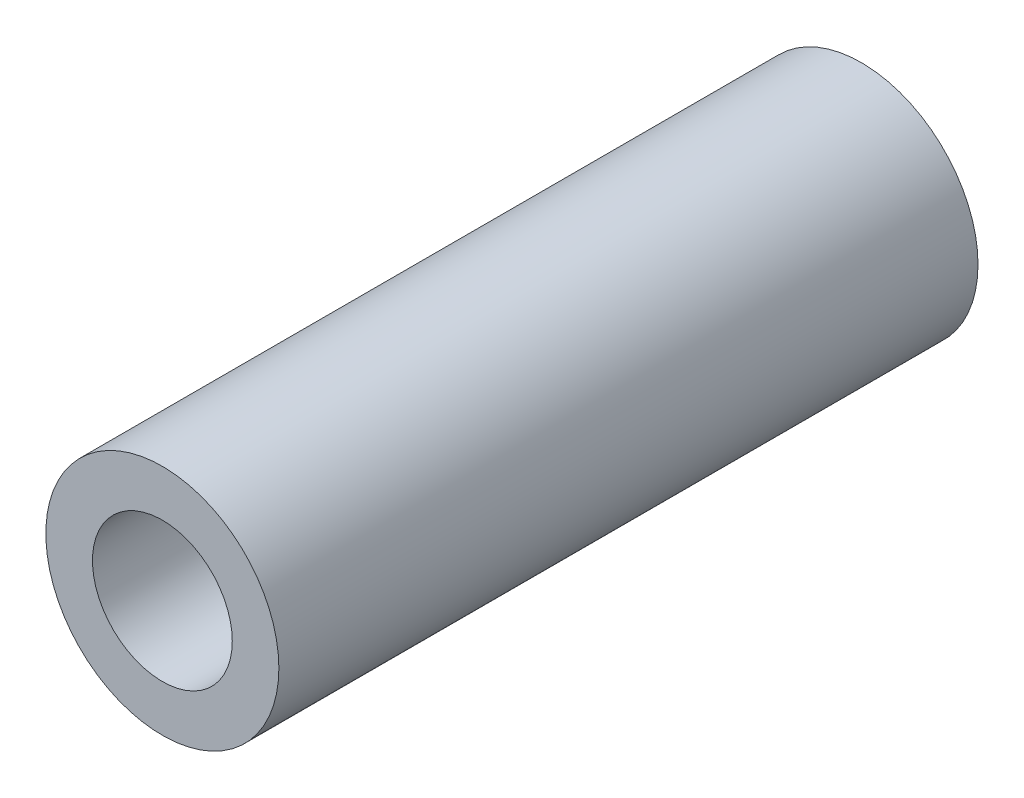
from build123d import *

# Parameters (mm, degrees)
SKETCH_1_R      = 5
SKETCH_1_R_2    = 3
EXTRUDE_1_DEPTH = 30


with BuildPart() as part:
    # 草图1 → 凸台-拉伸1 (new body)
    with BuildSketch(Plane.XY):
        Circle(SKETCH_1_R)
        Circle(SKETCH_1_R_2, mode=Mode.SUBTRACT)
    extrude(amount=EXTRUDE_1_DEPTH)


solid = part.part
